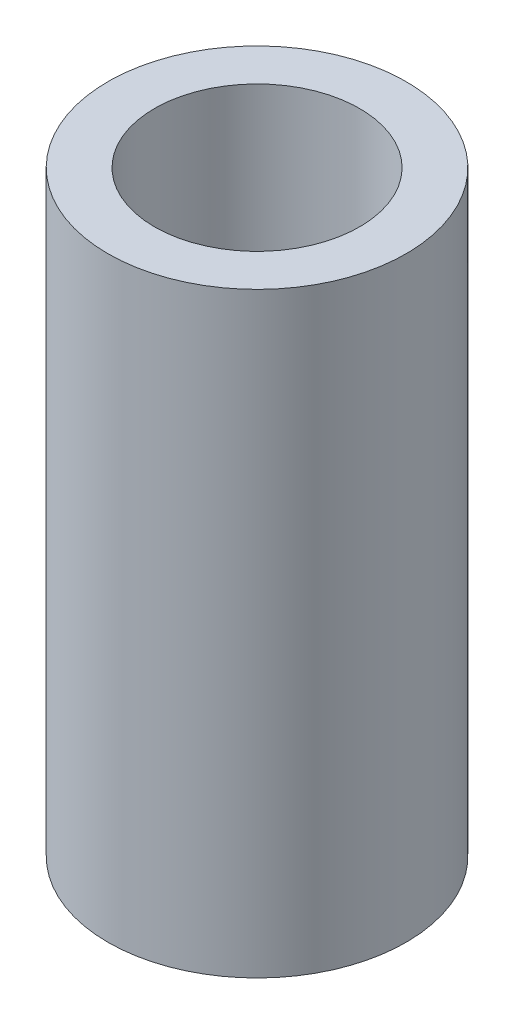
from build123d import *

# Parameters (mm, degrees)
SKETCH1_R             = 1.5875
BOSS_EXTRUDE1_DEPTH   = 6.35
F_2_56_TAPPED_HOLE1_D = 2.1844


with BuildPart() as part:
    # Sketch1 → Boss-Extrude1 (new body)
    with BuildSketch(Plane(origin=(0, 0, 0), x_dir=(1, 0, 0), z_dir=(0, 1, 0))):
        with Locations(Location((0, 0, 0), (0, 0, 270))):
            Circle(SKETCH1_R)
    extrude(amount=BOSS_EXTRUDE1_DEPTH)

    # #2-56 Tapped Hole1 (through all)
    with Locations(Plane(origin=(0, 6.35, 0), x_dir=(1, 0, 0), z_dir=(0, 1, 0))):
        with Locations((0, 0)):
            Hole(F_2_56_TAPPED_HOLE1_D / 2)


solid = part.part
